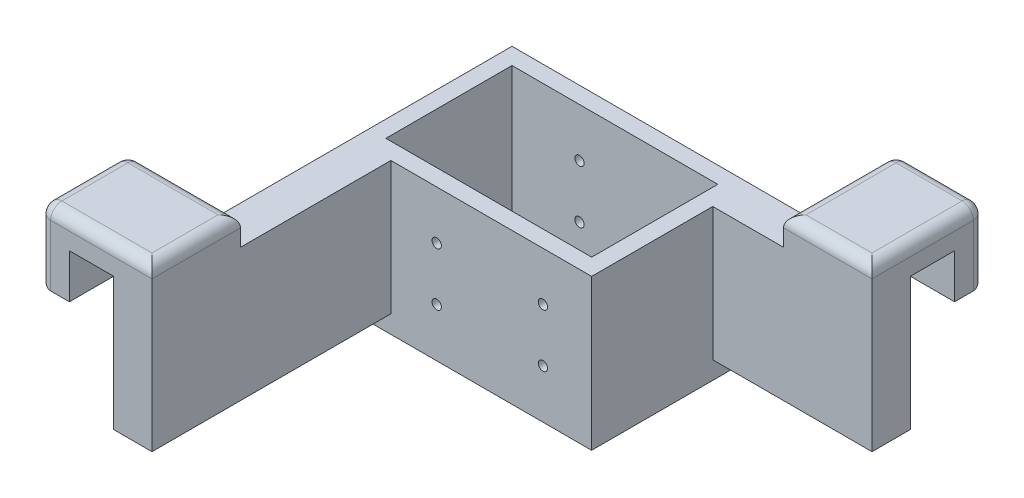
from build123d import *

# Parameters (mm, degrees)
SKETCH2_W           = 54.022158158
SKETCH2_H           = 36.022158158
SKETCH2_W_2         = 46.5
SKETCH2_H_2         = 28.5
BOSS_EXTRUDE1_DEPTH = 34.036
SKETCH3_W           = 8.658958029
SKETCH3_H           = 53.977841842
SKETCH3_W_2         = 35.977841842
SKETCH3_H_2         = 8.658958029
BOSS_EXTRUDE2_DEPTH = 30
BOSS_EXTRUDE3_DEPTH = 6.35
SKETCH5_W           = 20
SKETCH5_H           = 6.78
SKETCH5_W_2         = 6.78
SKETCH5_H_2         = 20
BOSS_EXTRUDE4_DEPTH = 10
FILLET1_R           = 2.54
SKETCH11_R          = 1.049999932
CUT_EXTRUDE1_DEPTH  = 132.751467908


with BuildPart() as part:
    # Sketch2 → Boss-Extrude1 (new body)
    with BuildSketch(Plane(origin=(0, 0, 0), x_dir=(1, 0, 0), z_dir=(0, 1, 0))):
        with Locations((27.011079079, -18.011079079)):
            Rectangle(SKETCH2_W, SKETCH2_H)
        with Locations((27.011079079, -18.011079079)):
            Rectangle(SKETCH2_W_2, SKETCH2_H_2, mode=Mode.SUBTRACT)
    extrude(amount=-BOSS_EXTRUDE1_DEPTH)

    # Sketch3 → Boss-Extrude2 (add)
    with BuildSketch(Plane(origin=(0, 0, 0), x_dir=(1, 0, 0), z_dir=(0, 1, 0))):
        with Locations((4.329479015, -63.011079079)):
            Rectangle(SKETCH3_W, SKETCH3_H)
        with Locations((72.011079079, -4.329479015)):
            Rectangle(SKETCH3_W_2, SKETCH3_H_2)
    extrude(amount=-BOSS_EXTRUDE2_DEPTH)

    # Sketch4 → Boss-Extrude3 (add)
    with BuildSketch(Plane(origin=(0, 0, 0), x_dir=(1, 0, 0), z_dir=(0, 1, 0))):
        Polygon((0, -90), (8.658958029, -90), (8.658958029, -70), (0, -70), (-10, -70), (-16.78, -70), (-16.78, -90), (-10, -90), align=None)
        Polygon((90, -8.658958029), (90, 0), (90, 10), (90, 16.78), (70, 16.78), (70, 10), (70, 0), (70, -8.658958029), align=None)
    extrude(amount=BOSS_EXTRUDE3_DEPTH)

    # Sketch5 → Boss-Extrude4 (add)
    with BuildSketch(Plane.XZ):
        with Locations((80, -13.39)):
            Rectangle(SKETCH5_W, SKETCH5_H)
        with Locations((-13.39, 80)):
            Rectangle(SKETCH5_W_2, SKETCH5_H_2)
    extrude(amount=BOSS_EXTRUDE4_DEPTH)

    # Fillet1
    fillet1_edges = [part.edges().sort_by_distance(p)[0] for p in [
        (70, -1.825, -16.78),
        (80, -10, -16.78),
        (90, -1.825, -16.78),
        (-16.78, -1.825, 90),
        (-16.78, -10, 80),
        (-16.78, -1.825, 70),
        (70, 6.35, -4.060520985),
        (80, 6.35, -16.78),
        (90, 6.35, -4.060520985),
        (80, 6.35, 8.658958029),
        (-16.78, 6.35, 80),
        (-4.060520985, 6.35, 70),
        (8.658958029, 6.35, 80),
        (-4.060520985, 6.35, 90),
    ]]
    fillet(fillet1_edges, radius=FILLET1_R)

    # Sketch11 → Cut-Extrude1 (cut, through all)
    with BuildSketch(Plane(origin=(0, 0, 0), x_dir=(-1, 0, 0), z_dir=(0, 0, -1))):
        with Locations((-19.011079079, -11)):
            Circle(SKETCH11_R)
        with Locations((-19.011079079, -23)):
            Circle(SKETCH11_R)
        with Locations((-43.01107908, -11)):
            Circle(SKETCH11_R)
        with Locations((-43.011079079, -23)):
            Circle(SKETCH11_R)
    extrude(amount=-CUT_EXTRUDE1_DEPTH, mode=Mode.SUBTRACT)


solid = part.part
